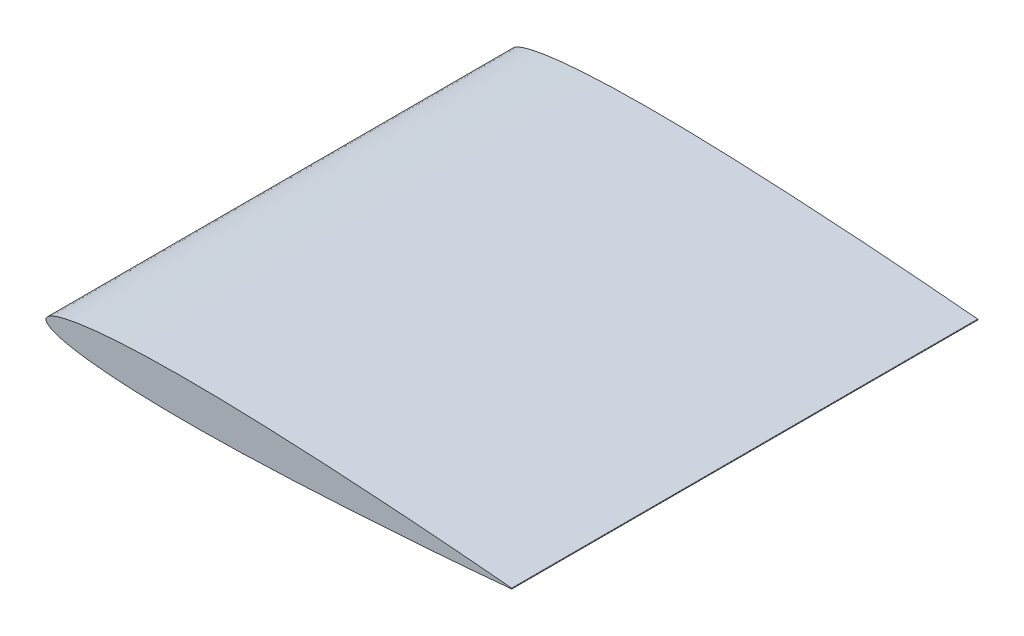
from build123d import *

# Parameters (mm, degrees)
BOSS_EXTRUDE1_DEPTH = 190.5


with BuildPart() as part:
    # Sketch1 → Boss-Extrude1 (new body)
    with BuildSketch(Plane.XY):
        with BuildLine():
            ThreePointArc((142.729373899, 0.159972039), (142.875, 0), (142.729216596, -0.159828701))
            add(Edge.make_bspline(
                [(142.729373899, 0.159972039), (142.479186782, 0.183389241), (142.088604253, 0.220145093), (141.526697731, 0.272742751), (141.012814784, 0.320538817), (140.406748418, 0.376789486), (139.708986665, 0.441220047), (138.920333107, 0.514035668), (138.041417357, 0.594304208), (137.07322957, 0.68224904), (136.016765435, 0.77810796), (134.872993078, 0.880464917), (133.643037518, 0.990222816), (132.32810814, 1.106528878), (130.929495464, 1.229245058), (129.44862656, 1.357746009), (127.886955115, 1.492381304), (126.24595721, 1.632297738), (124.527338312, 1.777077733), (122.732803785, 1.927068314), (120.864080123, 2.081358861), (118.922876779, 2.239575487), (116.911283182, 2.402069021), (114.831256695, 2.567619672), (112.684865067, 2.736304584), (110.474213261, 2.907957107), (108.201422873, 3.081797728), (105.868808461, 3.257838089), (103.478652207, 3.435681189), (101.033200968, 3.614497356), (98.535048779, 3.794670679), (95.98657076, 3.975395915), (93.390301345, 4.156228946), (90.748818387, 4.337309633), (88.064660392, 4.517397443), (85.340543328, 4.696857729), (82.579131379, 4.87532488), (79.783103947, 5.051644893), (76.955374618, 5.226293293), (74.098572622, 5.398388046), (71.215634796, 5.5677223), (67.327609501, 5.789513992), (63.414112746, 6.003441606), (59.478809548, 6.207161812), (56.50792675, 6.355947173), (53.528129982, 6.498740712), (50.5425001, 6.635728823), (47.553957983, 6.766566681), (44.56539541, 6.89018126), (41.579752921, 7.006622097), (38.599952487, 7.115597717), (35.629015167, 7.2159622), (32.669822502, 7.307988734), (29.725334591, 7.390644058), (26.798429096, 7.464270978), (23.891998133, 7.527448872), (21.008986749, 7.580929164), (18.152098321, 7.623099522), (15.324274724, 7.655123659), (12.528160471, 7.67505609), (8.871610591, 7.686683977), (5.266457164, 7.675001781), (1.71647728, 7.637734373), (-0.879931687, 7.597722483), (-3.428566875, 7.545006259), (-5.926905154, 7.479949018), (-8.372507278, 7.401596136), (-10.762875895, 7.311037695), (-13.095681861, 7.207190804), (-15.36867937, 7.090984589), (-17.579561617, 6.962095589), (-19.726191271, 6.820915439), (-22.454703609, 6.619335498), (-25.090072814, 6.391901614), (-27.628833308, 6.135255481), (-29.423658036, 5.934564214), (-31.1426492, 5.723671702), (-32.783978198, 5.501534274), (-34.346086761, 5.269571307), (-35.82737669, 5.027612668), (-37.226486733, 4.776179476), (-38.541989636, 4.515732915), (-39.772561425, 4.246397612), (-40.917043219, 3.96904878), (-41.974491671, 3.684066927), (-42.943679341, 3.391172979), (-43.823899268, 3.091425583), (-44.614394257, 2.785299988), (-45.314232342, 2.47223321), (-45.923388039, 2.153530359), (-46.441203734, 1.828452448), (-46.867747355, 1.497347253), (-47.203119095, 1.15947565), (-47.446018213, 0.813039564), (-47.594741214, 0.456996953), (-47.644530227, 0.093712517), (-47.595098621, -0.269620724), (-47.446725953, -0.625809471), (-47.204167761, -0.972484342), (-46.869128567, -1.310685706), (-46.442910879, -1.642210357), (-45.925415233, -1.967797515), (-45.316573357, -2.287099474), (-44.617043593, -2.600854571), (-43.826850139, -2.907757672), (-42.946925516, -3.208370847), (-41.978026452, -3.502218098), (-40.920858864, -3.788240087), (-39.776650468, -4.066714676), (-38.546344236, -4.337260433), (-37.231098185, -4.599001003), (-35.832236169, -4.851810459), (-34.351184985, -5.09522621), (-32.789305373, -5.328725801), (-31.148195699, -5.552477792), (-29.429412834, -5.765061272), (-27.634786405, -5.967518113), (-25.096279617, -6.226661647), (-22.461135428, -6.456687984), (-19.732822716, -6.660952022), (-17.586332988, -6.804243866), (-15.375578606, -6.935307775), (-13.102696516, -7.053750012), (-10.769993838, -7.159891768), (-8.379715466, -7.252801707), (-5.934191606, -7.333560431), (-3.435918536, -7.401075399), (-0.887336441, -7.456298836), (1.709031908, -7.498864943), (5.258973412, -7.539624652), (8.864113602, -7.554853439), (12.520673152, -7.546822715), (15.31680566, -7.529640991), (18.144659393, -7.500398763), (21.001587924, -7.46103891), (23.884650525, -7.410394827), (26.791142232, -7.350076187), (29.718118743, -7.279328667), (32.662686542, -7.199570044), (35.621968307, -7.110454683), (38.593002923, -7.01301293), (41.572909121, -6.906968762), (44.558664715, -6.79346513), (47.547347448, -6.672790631), (50.536016832, -6.544892837), (53.521780032, -6.410841927), (56.501715832, -6.270979855), (59.472743561, -6.125117194), (63.408245267, -5.92526847), (67.321950581, -5.71519089), (71.210192183, -5.497224179), (74.093295198, -5.330726118), (76.950265112, -5.161441848), (79.778164884, -4.989575332), (82.574364419, -4.816006017), (85.3359506, -4.640255512), (88.060242891, -4.463475183), (90.74457675, -4.28602802), (93.386236569, -4.107545999), (95.982682624, -3.929267155), (98.5313372, -3.75104909), (101.029665426, -3.57333343), (103.475291394, -3.39692308), (105.865621446, -3.2214314), (108.19840791, -3.047685851), (110.471368215, -2.876081188), (112.682187816, -2.706603493), (114.828744351, -2.540030191), (116.908932692, -2.376525861), (118.92068517, -2.216011326), (120.862043222, -2.05970445), (122.730917764, -1.907252348), (124.525598977, -1.759027226), (126.244359471, -1.615938005), (127.885494227, -1.477635983), (129.447297364, -1.344537058), (130.928291966, -1.217492986), (132.327024688, -1.09615276), (133.642067846, -0.981140326), (134.872130786, -0.872592457), (136.016003284, -0.771360745), (137.07256121, -0.676541175), (138.040835044, -0.589548848), (138.919829335, -0.510144987), (139.708554143, -0.438105245), (140.406378943, -0.374361143), (141.012500352, -0.318706723), (141.714019078, -0.254154754), (142.275954493, -0.201866145), (142.666585451, -0.16562875), (142.729216596, -0.159828701)],
                knots=[0, 0, 0, 0, 0.001960488, 0.003060783, 0.004403151, 0.0059871, 0.007809627, 0.009870238, 0.012166335, 0.014695452, 0.017455125, 0.020442713, 0.023654809, 0.027089354, 0.030741825, 0.034608687, 0.038686488, 0.042971159, 0.047458181, 0.052142622, 0.057020911, 0.062087544, 0.067338084, 0.072766456, 0.078367198, 0.084135835, 0.090065843, 0.096151268, 0.102386612, 0.108765354, 0.11528158, 0.121927783, 0.128698472, 0.135586708, 0.14258496, 0.14968731, 0.156886298, 0.164174398, 0.171545202, 0.178990235, 0.186503524, 0.1940766, 0.209373857, 0.217082105, 0.224820878, 0.232581679, 0.240357098, 0.248139213, 0.255920557, 0.263693736, 0.271450842, 0.279184434, 0.286886143, 0.294549552, 0.302166305, 0.309729004, 0.317230803, 0.324663343, 0.332020788, 0.339294805, 0.34647908, 0.360549207, 0.367421989, 0.374177392, 0.38080867, 0.387310567, 0.393675894, 0.399898905, 0.405973449, 0.411894305, 0.417655823, 0.423251855, 0.428678294, 0.439001415, 0.443888497, 0.448586274, 0.453091622, 0.457400294, 0.461508301, 0.46541243, 0.469110006, 0.472598492, 0.475874567, 0.478937452, 0.481785324, 0.484418023, 0.486835408, 0.489038388, 0.491029428, 0.49281391, 0.494397941, 0.495793426, 0.497018052, 0.498098706, 0.499074548, 0.5, 0.500925452, 0.501901294, 0.502981948, 0.504206574, 0.505602059, 0.50718609, 0.508970572, 0.510961612, 0.513164592, 0.515581977, 0.518214676, 0.521062548, 0.524125433, 0.527401508, 0.530889994, 0.53458757, 0.538491699, 0.542599706, 0.546908378, 0.551413726, 0.556111503, 0.560998585, 0.571321706, 0.576748145, 0.582344177, 0.588105695, 0.594026551, 0.600101095, 0.606324106, 0.612689433, 0.61919133, 0.625822608, 0.632578011, 0.639450793, 0.65352092, 0.660705195, 0.667979212, 0.675336657, 0.682769197, 0.690270996, 0.697833695, 0.705450448, 0.713113857, 0.720815566, 0.728549158, 0.736306264, 0.744079443, 0.751860787, 0.759642902, 0.767418321, 0.775179122, 0.782917895, 0.790626143, 0.8059234, 0.813496476, 0.821009765, 0.828454798, 0.835825602, 0.843113702, 0.85031269, 0.85741504, 0.864413292, 0.871301528, 0.878072217, 0.88471842, 0.891234646, 0.897613388, 0.903848732, 0.909934157, 0.915864165, 0.921632802, 0.927233544, 0.932661916, 0.937912456, 0.942979089, 0.947857378, 0.952541819, 0.957028841, 0.961313512, 0.965391313, 0.969258175, 0.972910646, 0.976345191, 0.979557287, 0.982544875, 0.985304548, 0.987833665, 0.990129762, 0.992190373, 0.9940129, 0.995596849, 0.996939217, 0.999509262, 1, 1, 1, 1], degree=3))
        make_face()
    extrude(amount=-BOSS_EXTRUDE1_DEPTH)


solid = part.part
